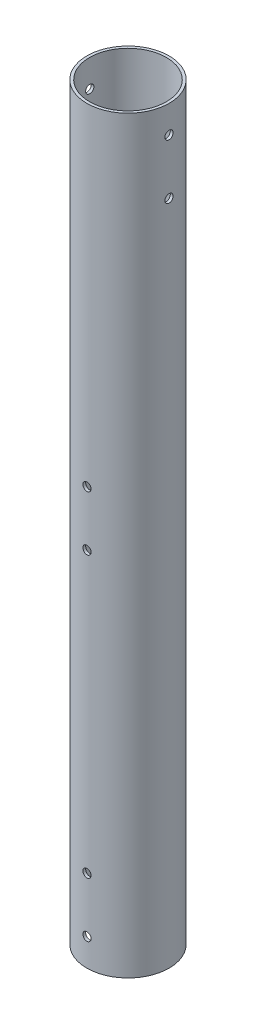
from build123d import *

# Parameters (mm, degrees)
SKETCH_1_R               = 15
EXTRUDE_1_DEPTH          = 273
CUT_EXTRUDE_1_DEPTH      = 274.822935489
CUT_EXTRUDE_1_DEPTH_BACK = 274.822935489
SKETCH_2_R               = 1.5
CUT_EXTRUDE_2_DEPTH      = 274.8229356
CUT_EXTRUDE_2_DEPTH_BACK = 274.8229356
SKETCH_3_R               = 1.5
CUT_EXTRUDE_3_REACH      = 275.823
SKETCH_4_R               = 14


with BuildPart() as part:
    # 草圖1 → 填料-伸長1 (new body)
    with BuildSketch(Plane(origin=(0, 0, 0), x_dir=(1, 0, 0), z_dir=(0, 1, 0))):
        with Locations(Location((0, 0, 0), (0, 0, 270))):
            Circle(SKETCH_1_R)
    extrude(amount=EXTRUDE_1_DEPTH)

    # 草圖2 → 除料-伸長1 (cut, two sides: drawn at the far end of the back side and taken through both)
    with BuildSketch(Plane.XY.offset(-CUT_EXTRUDE_1_DEPTH_BACK)):
        with Locations((0, 10)):
            Circle(SKETCH_2_R)
        with Locations((0, 30)):
            Circle(SKETCH_2_R)
        with Locations((0, 132)):
            Circle(SKETCH_2_R)
        with Locations((0, 152)):
            Circle(SKETCH_2_R)
    extrude(amount=CUT_EXTRUDE_1_DEPTH + CUT_EXTRUDE_1_DEPTH_BACK, mode=Mode.SUBTRACT)

    # 草圖3 → 除料-伸長2 (cut, two sides: drawn at the far end of the back side and taken through both)
    with BuildSketch(Plane(origin=(0, 0, 0), x_dir=(0, 0, -1), z_dir=(1, 0, 0)).offset(-CUT_EXTRUDE_2_DEPTH_BACK)):
        with Locations((0, 263)):
            Circle(SKETCH_3_R)
        with Locations((0, 243)):
            Circle(SKETCH_3_R)
    extrude(amount=CUT_EXTRUDE_2_DEPTH + CUT_EXTRUDE_2_DEPTH_BACK, mode=Mode.SUBTRACT)

    # 草圖4 → 除料-伸長3 (cut, up to next)
    with BuildSketch(Plane(origin=(0, 273, 0), x_dir=(1, 0, 0), z_dir=(0, 1, 0)), mode=Mode.PRIVATE) as cut_extrude_3_sk1:
        with Locations(Location((0, 0, 0), (0, 0, 270))):
            Circle(SKETCH_4_R)
    cut_extrude_3_tool1 = extrude(cut_extrude_3_sk1.sketch, amount=-CUT_EXTRUDE_3_REACH, mode=Mode.PRIVATE) & part.part
    add(cut_extrude_3_tool1.solids().sort_by_distance((0, 273, 0))[0], mode=Mode.SUBTRACT)


solid = part.part
